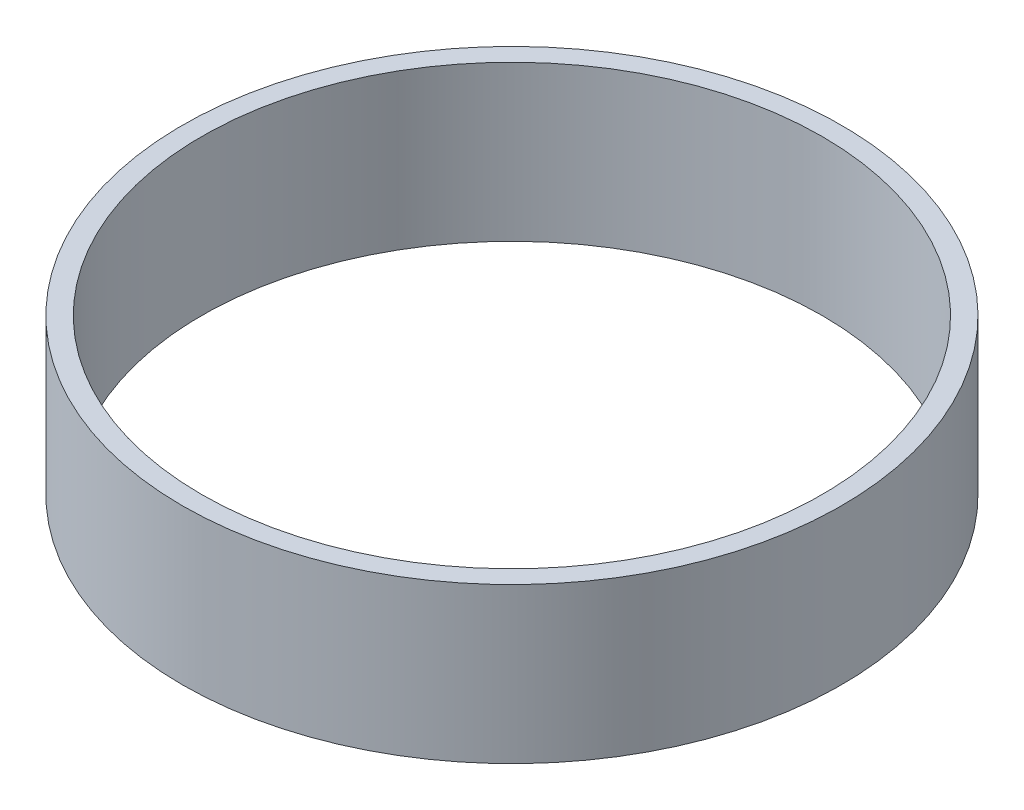
from build123d import *

# Parameters (mm, degrees)
ESQUISSE1_R        = 85
ESQUISSE1_R_2      = 80
BOSS_EXTRU_1_DEPTH = 40


with BuildPart() as part:
    # Esquisse1 → Boss.-Extru.1 (new body)
    with BuildSketch(Plane(origin=(0, 0, 0), x_dir=(1, 0, 0), z_dir=(0, 1, 0))):
        with Locations(Location((0, 0, 0), (0, 0, 270))):
            Circle(ESQUISSE1_R)
        with Locations(Location((0, 0, 0), (0, 0, 270))):
            Circle(ESQUISSE1_R_2, mode=Mode.SUBTRACT)
    extrude(amount=BOSS_EXTRU_1_DEPTH)


solid = part.part
